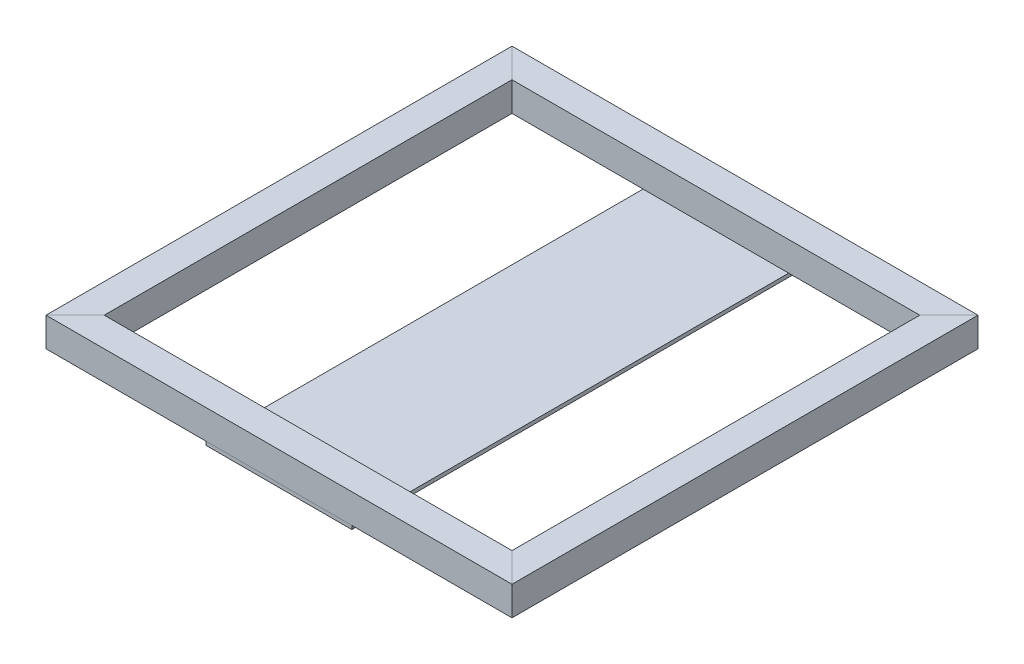
from build123d import *

# Parameters (mm, degrees)
TUBO_CUADRADO_20_X_20_X_2_2_DEPTH      = 315.142135624
TUBO_CUADRADO_20_X_20_X_2_2_DEPTH_BACK = 15.142135624
SKETCH1_W                              = 20
SKETCH1_H                              = 20
SKETCH1_W_2                            = 16
SKETCH1_H_2                            = 16
SKETCH1_ON_SEGMENT_2_W                 = 20
SKETCH1_ON_SEGMENT_2_H                 = 20
SKETCH1_ON_SEGMENT_2_W_2               = 16
SKETCH1_ON_SEGMENT_2_H_2               = 16
TUBO_CUADRADO_20_X_20_X_2_2_2_DEPTH    = 330.284271247
SKETCH1_ON_SEGMENT_3_W                 = 20
SKETCH1_ON_SEGMENT_3_H                 = 20
SKETCH1_ON_SEGMENT_3_W_2               = 16
SKETCH1_ON_SEGMENT_3_H_2               = 16
TUBO_CUADRADO_20_X_20_X_2_2_3_DEPTH    = 330.284271247
SKETCH1_ON_SEGMENT_4_W                 = 20
SKETCH1_ON_SEGMENT_4_H                 = 20
SKETCH1_ON_SEGMENT_4_W_2               = 16
SKETCH1_ON_SEGMENT_4_H_2               = 16
TUBO_CUADRADO_20_X_20_X_2_2_4_DEPTH    = 330.284271247
CROQUIS3_W                             = 100
CROQUIS3_H                             = 320
SALIENTE_EXTRUIR1_DEPTH                = 2.5


with BuildPart() as part:
    # Sketch1 → Tubo cuadrado 20 X 20 X 2(2) (new, two sides: drawn at the far end of the back side and taken through both)
    with BuildSketch(Plane(origin=(-150, 0, -150), x_dir=(1, 0, 0), z_dir=(0, 0, 1)).offset(-TUBO_CUADRADO_20_X_20_X_2_2_DEPTH_BACK)):
        Rectangle(SKETCH1_W, SKETCH1_H)
        Rectangle(SKETCH1_W_2, SKETCH1_H_2, mode=Mode.SUBTRACT)
    extrude(amount=TUBO_CUADRADO_20_X_20_X_2_2_DEPTH + TUBO_CUADRADO_20_X_20_X_2_2_DEPTH_BACK)

    # Tubo cuadrado 20 X 20 X 2(2) mitre 1
    split(bisect_by=Plane(origin=(-150, 0, -150), x_dir=(0, -1, 0), z_dir=(-0.707106781, 0, 0.707106781)), keep=Keep.TOP)

    # Tubo cuadrado 20 X 20 X 2(2) mitre 2
    split(bisect_by=Plane(origin=(-150, 0, 150), x_dir=(0, -1, 0), z_dir=(-0.707106781, 0, -0.707106781)), keep=Keep.TOP)


with BuildPart() as body_2:
    # Sketch1 on segment 2 (carried to segment 2) → Tubo cuadrado 20 X 20 X 2_2 2 (new body)
    with BuildSketch(Plane(origin=(-165.142135624, 0, 150), x_dir=(0, 0, -1), z_dir=(1, 0, 0))):
        Rectangle(SKETCH1_ON_SEGMENT_2_W, SKETCH1_ON_SEGMENT_2_H)
        Rectangle(SKETCH1_ON_SEGMENT_2_W_2, SKETCH1_ON_SEGMENT_2_H_2, mode=Mode.SUBTRACT)
    extrude(amount=TUBO_CUADRADO_20_X_20_X_2_2_2_DEPTH)

    # Tubo cuadrado 20 X 20 X 2_2 2 mitre 1
    split(bisect_by=Plane(origin=(-150, 0, 150), x_dir=(0, 1, 0), z_dir=(0.707106781, 0, 0.707106781)), keep=Keep.TOP)

    # Tubo cuadrado 20 X 20 X 2_2 2 mitre 2
    split(bisect_by=Plane(origin=(150, 0, 150), x_dir=(0, -1, 0), z_dir=(-0.707106781, 0, 0.707106781)), keep=Keep.TOP)


with BuildPart() as body_3:
    # Sketch1 on segment 3 (carried to segment 3) → Tubo cuadrado 20 X 20 X 2_2 3 (new body)
    with BuildSketch(Plane(origin=(150, 0, 165.142135624), x_dir=(-1, 0, 0), z_dir=(0, 0, -1))):
        Rectangle(SKETCH1_ON_SEGMENT_3_W, SKETCH1_ON_SEGMENT_3_H)
        Rectangle(SKETCH1_ON_SEGMENT_3_W_2, SKETCH1_ON_SEGMENT_3_H_2, mode=Mode.SUBTRACT)
    extrude(amount=TUBO_CUADRADO_20_X_20_X_2_2_3_DEPTH)

    # Tubo cuadrado 20 X 20 X 2_2 3 mitre 1
    split(bisect_by=Plane(origin=(150, 0, -150), x_dir=(0, 1, 0), z_dir=(0.707106781, 0, 0.707106781)), keep=Keep.TOP)

    # Tubo cuadrado 20 X 20 X 2_2 3 mitre 2
    split(bisect_by=Plane(origin=(150, 0, 150), x_dir=(0, 1, 0), z_dir=(0.707106781, 0, -0.707106781)), keep=Keep.TOP)


with BuildPart() as body_4:
    # Sketch1 on segment 4 (carried to segment 4) → Tubo cuadrado 20 X 20 X 2_2 4 (new body)
    with BuildSketch(Plane(origin=(165.142135624, 0, -150), x_dir=(0, 0, 1), z_dir=(-1, 0, 0))):
        Rectangle(SKETCH1_ON_SEGMENT_4_W, SKETCH1_ON_SEGMENT_4_H)
        Rectangle(SKETCH1_ON_SEGMENT_4_W_2, SKETCH1_ON_SEGMENT_4_H_2, mode=Mode.SUBTRACT)
    extrude(amount=TUBO_CUADRADO_20_X_20_X_2_2_4_DEPTH)

    # Tubo cuadrado 20 X 20 X 2_2 4 mitre 1
    split(bisect_by=Plane(origin=(-150, 0, -150), x_dir=(0, 1, 0), z_dir=(0.707106781, 0, -0.707106781)), keep=Keep.TOP)

    # Tubo cuadrado 20 X 20 X 2_2 4 mitre 2
    split(bisect_by=Plane(origin=(150, 0, -150), x_dir=(0, -1, 0), z_dir=(-0.707106781, 0, -0.707106781)), keep=Keep.TOP)


with BuildPart() as body_5:
    # Croquis3 → Saliente-Extruir1 (new body)
    with BuildSketch(Plane(origin=(0, -10, 0), x_dir=(1, 0, 0), z_dir=(0, 1, 0))):
        Rectangle(CROQUIS3_W, CROQUIS3_H)
    extrude(amount=-SALIENTE_EXTRUIR1_DEPTH)


solid = Compound([part.part, body_2.part, body_3.part, body_4.part, body_5.part])
